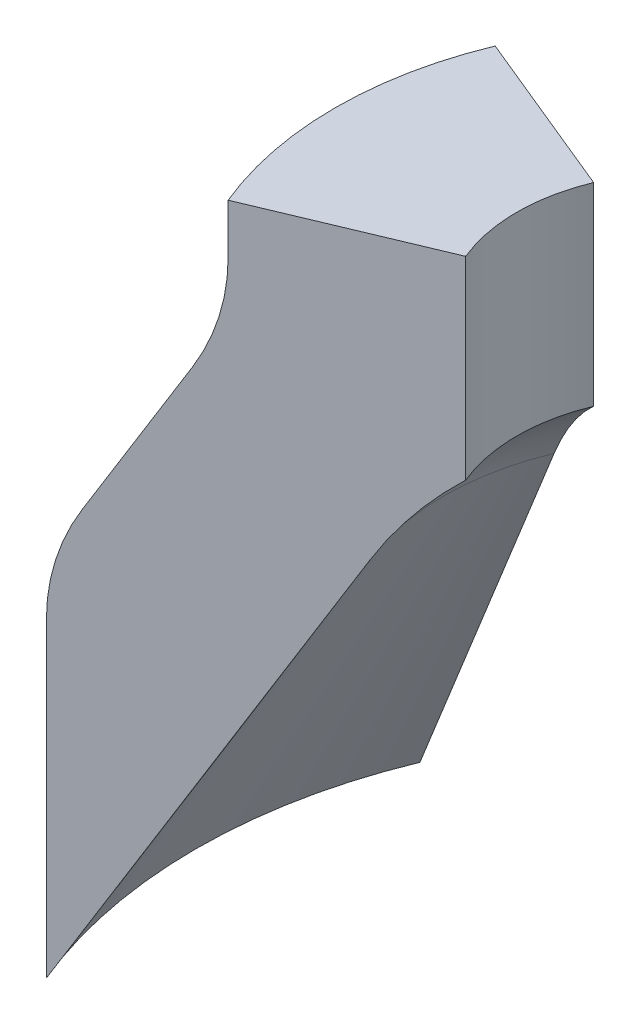
from build123d import *

# Parameters (mm, degrees)
REVOLVE1_ANGLE     = 45
CUT_REVOLVE5_ANGLE = 23
SKETCH5_R          = 2.5
CUT_EXTRUDE1_DEPTH = 2.55


with BuildPart() as part:
    # Sketch1 → Revolve1 (revolve, symmetric)
    with BuildSketch(Plane.XY) as revolve1_sk:
        with BuildLine():
            Line((-26.239989701, -17.447458038), (-26.239989701, -0.731138339))
            ThreePointArc((-26.239989701, -0.731138339), (-25.865330741, 2.115285345), (-24.766875558, 4.767811185))
            Line((-24.766875558, 4.767811185), (-20.234178791, 12.620671907))
            ThreePointArc((-20.234178791, 12.620671907), (-19.135723608, 15.273197747), (-18.761064648, 18.119621431))
            Line((-18.761064648, 18.119621431), (-18.761064648, 20.793898522))
            Line((-18.761064648, 20.793898522), (-8.983798531, 20.825060578))
            Line((-8.983798531, 20.825060578), (-8.983798531, 10.405785055))
            ThreePointArc((-8.983798531, 10.405785055), (-11.144661105, 8.19078498), (-12.908903509, 5.648541651))
            Line((-12.908903509, 5.648541651), (-26.239989701, -17.447458038))
        make_face()
    revolve(axis=Axis((0, 0, 0), (0, -1, 0)), revolution_arc=REVOLVE1_ANGLE / 2)
    revolve(revolve1_sk.sketch, axis=Axis((0, 0, 0), (0, 1, 0)), revolution_arc=REVOLVE1_ANGLE / 2)

    # Sketch4 → Cut-Revolve5 (revolve, symmetric, cut)
    with BuildSketch(Plane.XY) as cut_revolve5_sk:
        with BuildLine():
            Line((-18.06897746, 11.370910651), (-22.601674227, 3.51804993))
            ThreePointArc((-22.601674227, 3.51804993), (-23.450480505, 1.468370871), (-23.739989701, -0.731138339))
            Line((-23.739989701, -0.731138339), (-23.739989701, -8.115272969))
            Line((-23.739989701, -8.115272969), (-15.07410484, 6.898302907))
            ThreePointArc((-15.07410484, 6.898302907), (-13.438873503, 9.325699255), (-11.483798531, 11.503752607))
            Line((-11.483798531, 11.503752607), (-11.483798531, 18.317079893))
            Line((-11.483798531, 18.317079893), (-16.261064648, 18.301853813))
            Line((-16.261064648, 18.301853813), (-16.261064648, 18.119621431))
            ThreePointArc((-16.261064648, 18.119621431), (-16.720873371, 14.626283274), (-18.06897746, 11.370910651))
        make_face()
    revolve(axis=Axis((0, 0, 0), (0, -1, 0)), revolution_arc=CUT_REVOLVE5_ANGLE / 2, mode=Mode.SUBTRACT)
    revolve(cut_revolve5_sk.sketch, axis=Axis((0, 0, 0), (0, 1, 0)), revolution_arc=CUT_REVOLVE5_ANGLE / 2, mode=Mode.SUBTRACT)

    # Sketch5 → Cut-Extrude1 (cut)
    with BuildSketch(Plane(origin=(-0.071940118, 20.85344552, 0), x_dir=(-0.9999940495093123, -0.003449774770501149, 0), z_dir=(0.003449774770501149, -0.9999940495093123, 0))):
        with Locations(Location((13.8, 0, 0), (0, 0, 342.175900363))):
            Circle(SKETCH5_R)
    extrude(amount=CUT_EXTRUDE1_DEPTH, mode=Mode.SUBTRACT)


solid = part.part
